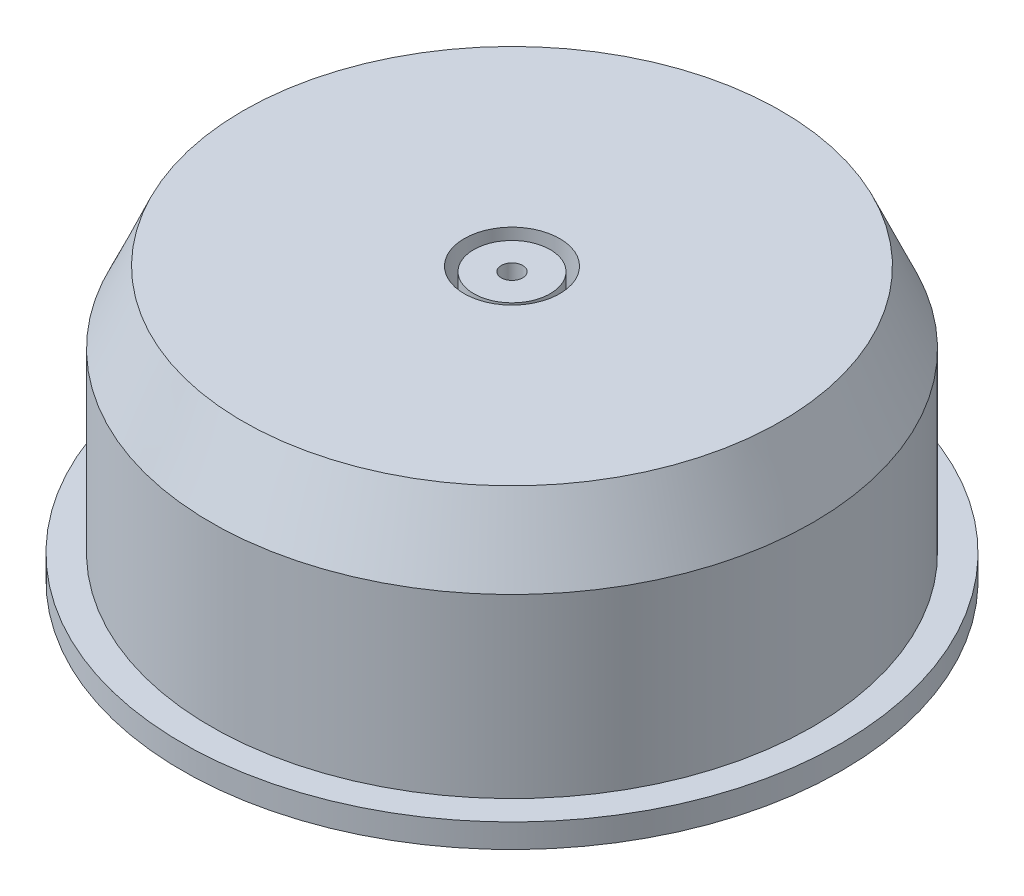
from build123d import *

# Parameters (mm, degrees)
EXTRUDE_START            = 27
SKETCH_3_R               = 8
EXTRUDE_1_DEPTH          = 27
SKETCH_4_W               = 21.869380784
SKETCH_4_H               = 6.809627549
CUT_EXTRUDE_1_DEPTH      = 23
SKETCH_5_R               = 3.5
CUT_EXTRUDE_2_DEPTH      = 70
PATTERN_CIRCULAR_1_COUNT = 6
HOLE_WIZARD_M41_D        = 4.5
HOLE_WIZARD_M41_DEPTH    = 14
HOLE_WIZARD_M41_TIP      = 1.351936393
SKETCH_14_R              = 9.95061624
SKETCH_14_R_2            = 8
CUT_EXTRUDE_5_DEPTH      = 10


with BuildPart() as part:
    # Эскиз2 → Повернуть1 (revolve)
    with BuildSketch(Plane.XY):
        Polygon((-10, -1.978246769), (-56.333333333, -1.978246769), (-63, -16.978246769), (-63, -53.978246769), (-69, -53.978246769), (-69, -58.978246769), (-34.298944769, -58.978246769), (-25.298944769, -62.978246769), (0, -62.978246769), (0, -2.978246769), (-8, -2.978246769), (-8, -13.730591033), (-10, -13.730591033), align=None)
    revolve(axis=Axis((0, -2.978246769, 0), (0, -1, 0)))

    # Эскиз3 → Бобышка-Вытянуть1 (add)
    with BuildSketch(Plane.XZ.offset(62.978246769).offset(EXTRUDE_START)):
        with Locations(Location((0, 0, 0), (0, 0, 180))):
            Circle(SKETCH_3_R)
    extrude(amount=-EXTRUDE_1_DEPTH)

    # Эскиз4 → Вырез-Вытянуть1 (cut)
    with BuildSketch(Plane.XZ.offset(89.978246769)):
        with Locations((-0.065477188, 8.404813774)):
            Rectangle(SKETCH_4_W, SKETCH_4_H)
    extrude(amount=-CUT_EXTRUDE_1_DEPTH, mode=Mode.SUBTRACT)

    # Эскиз5 → Вырез-Вытянуть2 (cut)
    with BuildSketch(Plane.XZ.offset(89.978246769)):
        with Locations(Location((0, 0, 0), (0, 0, 270))):
            Circle(SKETCH_5_R)
    extrude(amount=-CUT_EXTRUDE_2_DEPTH, mode=Mode.SUBTRACT)

    # Эскиз7 → Зенковка для винта с полупотайной головкой M51 (revolve, cut)
    with BuildSketch(Plane(origin=(-1.157683247, -58.978246769, -60), x_dir=(0, 0, -1), z_dir=(1, 0, 0))):
        Polygon((0, 0), (0, 15.652366702), (2.75, 14), (2.75, 2.45), (5.2, 0), align=None)
    hole_wizard_m51 = revolve(axis=Axis((-1.157683247, -65.328246769, -60), (0, 1, 0)), mode=Mode.SUBTRACT)

    # Круговой массив1: Зенковка для винта с полупотайной головкой M51 ×6 about axis
    pattern_circular_1_axis = Axis((0, 0, 0), (0, 1, 0))
    for i in range(1, PATTERN_CIRCULAR_1_COUNT):
        add(hole_wizard_m51.rotate(pattern_circular_1_axis, i * 360 / PATTERN_CIRCULAR_1_COUNT), mode=Mode.SUBTRACT)

    # Отверстие с зазором M41
    with Locations(Plane(origin=(0, -2.978246769, 0), x_dir=(1, 0, 0), z_dir=(0, 1, 0))):
        with Locations((0, 0)):
            Hole(HOLE_WIZARD_M41_D / 2, depth=HOLE_WIZARD_M41_DEPTH)
            with Locations((0, 0, -(HOLE_WIZARD_M41_DEPTH + HOLE_WIZARD_M41_TIP / 2))):  # 118° drill point
                Cone(0, HOLE_WIZARD_M41_D / 2, HOLE_WIZARD_M41_TIP, mode=Mode.SUBTRACT)

    # Эскиз14 → Вырез-Вытянуть5 (cut)
    with BuildSketch(Plane.XZ.offset(62.978246769)):
        Circle(SKETCH_14_R)
        with Locations(Location((0, 0, 0), (0, 0, 180))):
            Circle(SKETCH_14_R_2, mode=Mode.SUBTRACT)
    extrude(amount=-CUT_EXTRUDE_5_DEPTH, mode=Mode.SUBTRACT)


solid = part.part
